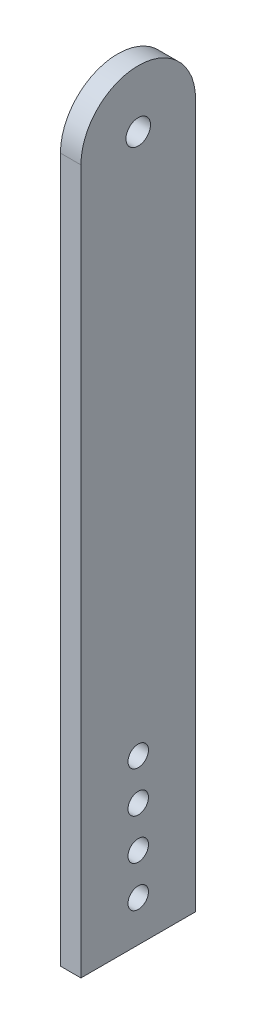
from build123d import *

# Parameters (mm, degrees)
SKETCH1_R           = 1.5
SKETCH1_R_2         = 1.25
BOSS_EXTRUDE1_DEPTH = 2.5


with BuildPart() as part:
    # Sketch1 → Boss-Extrude1 (new body)
    with BuildSketch(Plane(origin=(0, 0, 0), x_dir=(0, 0, -1), z_dir=(1, 0, 0))):
        with BuildLine():
            Line((-7, 10), (-7, 96))
            ThreePointArc((-7, 96), (0, 103), (7, 96))
            Line((7, 96), (7, 10))
            Line((7, 10), (-7, 10))
        make_face()
        with Locations((0, 96)):
            Circle(SKETCH1_R, mode=Mode.SUBTRACT)
        with Locations((0, 15)):
            Circle(SKETCH1_R_2, mode=Mode.SUBTRACT)
        with Locations((0, 20)):
            Circle(SKETCH1_R_2, mode=Mode.SUBTRACT)
        with Locations((0, 25)):
            Circle(SKETCH1_R_2, mode=Mode.SUBTRACT)
        with Locations((0, 30)):
            Circle(SKETCH1_R_2, mode=Mode.SUBTRACT)
    extrude(amount=BOSS_EXTRUDE1_DEPTH)


solid = part.part
